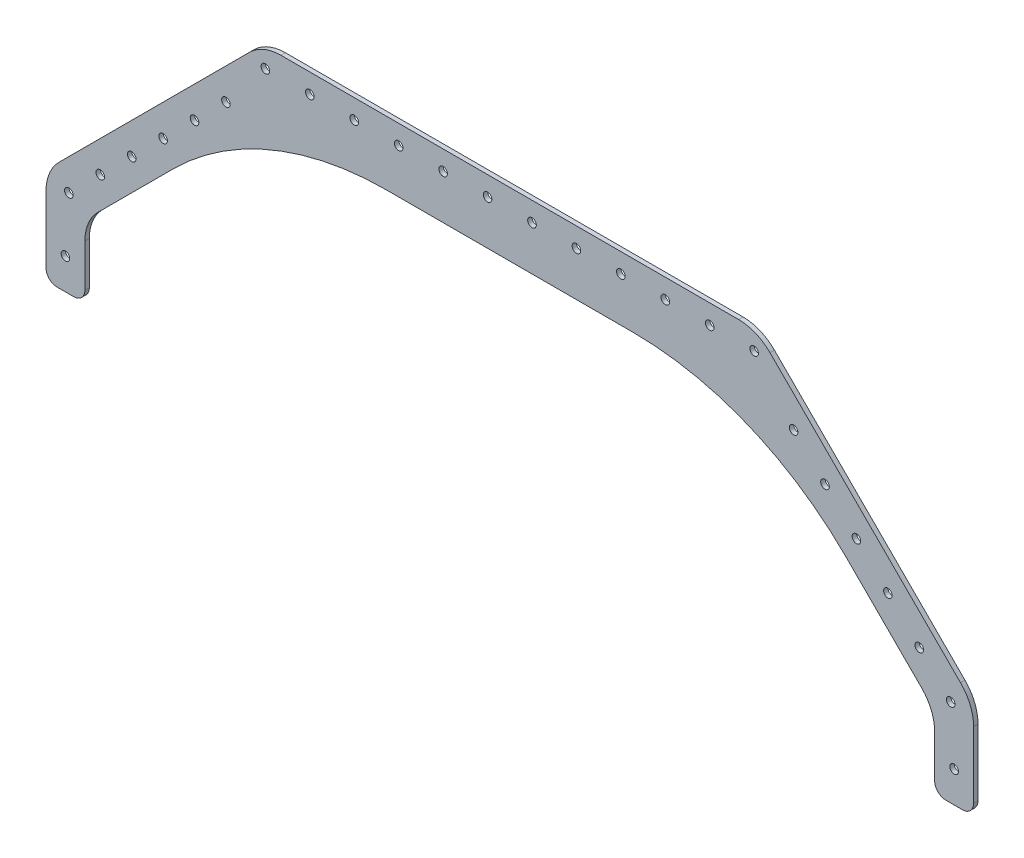
from build123d import *

# Parameters (mm, degrees)
BOSS_EXTRUDE1_DEPTH   = 2.54
F_8_CLEARANCE_HOLE1_D = 4.9149


with BuildPart() as part:
    # Sketch1 → Boss-Extrude1 (new body)
    with BuildSketch(Plane.XY):
        with BuildLine():
            Line((258.7625, 71.196211277), (249.2375, 71.196211277))
            ThreePointArc((249.2375, 71.196211277), (244.747371939, 73.056083217), (242.8875, 77.546211277))
            Line((242.8875, 77.546211277), (242.8875, 101.893951031))
            ThreePointArc((242.8875, 101.893951031), (240.954040126, 111.614110214), (235.448012242, 119.854463274))
            Line((235.448012242, 119.854463274), (192.383237758, 162.919237758))
            ThreePointArc((192.383237758, 162.919237758), (136.442161509, 200.297869889), (70.455162895, 213.4235))
            Line((70.455162895, 213.4235), (-70.455162895, 213.4235))
            ThreePointArc((-70.455162895, 213.4235), (-136.442161509, 200.297869889), (-192.383237758, 162.919237758))
            Line((-192.383237758, 162.919237758), (-235.448012242, 119.854463274))
            ThreePointArc((-235.448012242, 119.854463274), (-240.954040126, 111.614110214), (-242.8875, 101.893951031))
            Line((-242.8875, 101.893951031), (-242.8875, 77.546211277))
            ThreePointArc((-242.8875, 77.546211277), (-244.747371939, 73.056083217), (-249.2375, 71.196211277))
            Line((-249.2375, 71.196211277), (-258.7625, 71.196211277))
            ThreePointArc((-258.7625, 71.196211277), (-263.252628061, 73.056083217), (-265.1125, 77.546211277))
            Line((-265.1125, 77.546211277), (-265.1125, 115.589975516))
            ThreePointArc((-265.1125, 115.589975516), (-263.179040126, 125.310134698), (-257.673012242, 133.550487758))
            Line((-257.673012242, 133.550487758), (-148.726987758, 242.496512242))
            ThreePointArc((-148.726987758, 242.496512242), (-140.486634698, 248.002540126), (-130.766475516, 249.936))
            Line((-130.766475516, 249.936), (130.766475516, 249.936))
            ThreePointArc((130.766475516, 249.936), (140.486634698, 248.002540126), (148.726987758, 242.496512242))
            Line((148.726987758, 242.496512242), (257.673012242, 133.550487758))
            ThreePointArc((257.673012242, 133.550487758), (263.179040126, 125.310134698), (265.1125, 115.589975516))
            Line((265.1125, 115.589975516), (265.1125, 77.546211277))
            ThreePointArc((265.1125, 77.546211277), (263.252628061, 73.056083217), (258.7625, 71.196211277))
        make_face()
    extrude(amount=BOSS_EXTRUDE1_DEPTH)

    # #8 Clearance Hole1 (through all)
    with Locations(Plane(origin=(0, 0, 0), x_dir=(-1, 0, 0), z_dir=(0, 0, -1))):
        with Locations((-254, 88.9635), (-252.044186638, 121.21880112), (-234.083674396, 139.179313362), (-216.123162153, 157.139825604), (-198.162649911, 175.100337847), (-180.202137669, 193.060850089), (-114.3, 238.8235), (-88.9, 238.8235), (-63.5, 238.8235), (-38.1, 238.8235), (-12.7, 238.8235), (12.7, 238.8235), (38.1, 238.8235), (63.5, 238.8235), (88.9, 238.8235), (114.3, 238.8235), (139.7, 238.8235), (162.241625427, 211.021362331), (180.202137669, 193.060850089), (198.162649911, 175.100337847), (216.123162153, 157.139825604), (234.083674396, 139.179313362), (252.044186638, 121.21880112), (254, 88.9635), (-139.7, 238.8235), (-162.241625427, 211.021362331)):
            Hole(F_8_CLEARANCE_HOLE1_D / 2)


solid = part.part
